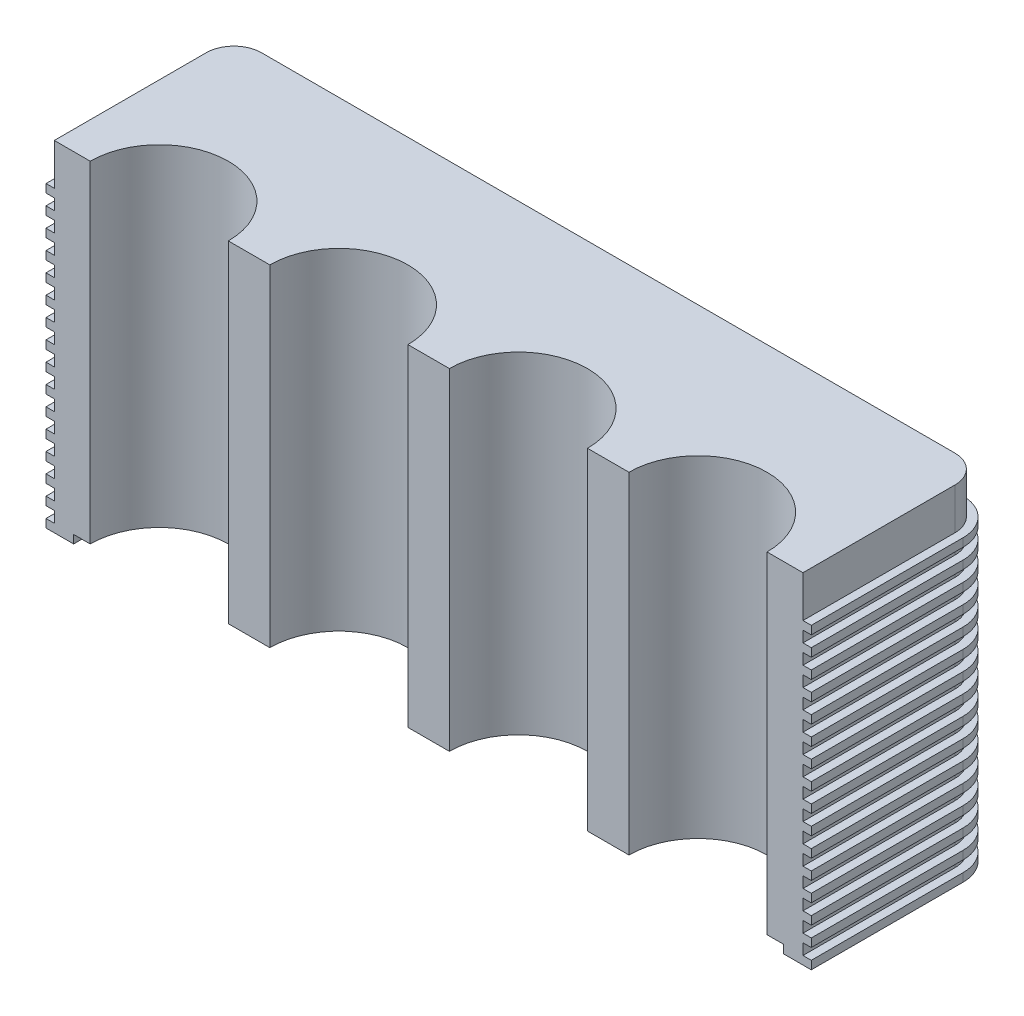
from build123d import *

# Parameters (mm, degrees)
BOSS_EXTRUDE1_DEPTH = 120
EXTRUDE_THIN1_DEPTH = 3
LPATTERN2_COUNT     = 16
LPATTERN2_PITCH     = 7


with BuildPart() as part:
    # Sketch1 → Boss-Extrude1 (new body)
    with BuildSketch(Plane(origin=(0, 0, 0), x_dir=(1, 0, 0), z_dir=(0, 1, 0))):
        with BuildLine():
            Line((0, 0), (13, 0))
            ThreePointArc((13, 0), (38, 25), (63, 0))
            Line((63, 0), (78, 0))
            ThreePointArc((78, 0), (103, 25), (128, 0))
            Line((128, 0), (143, 0))
            ThreePointArc((143, 0), (168, 25), (193, 0))
            Line((193, 0), (208, 0))
            ThreePointArc((208, 0), (233, 25), (258, 0))
            Line((258, 0), (271, 0))
            Line((271, 0), (271, 55))
            ThreePointArc((271, 55), (268.071067812, 62.071067812), (261, 65))
            Line((261, 65), (10, 65))
            ThreePointArc((10, 65), (2.928932188, 62.071067812), (0, 55))
            Line((0, 55), (0, 0))
        make_face()
    extrude(amount=BOSS_EXTRUDE1_DEPTH)

    # Sketch3 → Extrude-Thin1 (add)
    with BuildSketch(Plane.XZ):
        with BuildLine():
            Line((274, 0), (274, -55))
            ThreePointArc((274, -55), (270.192388155, -64.192388155), (261, -68))
            Line((261, -68), (10, -68))
            ThreePointArc((10, -68), (0.807611845, -64.192388155), (-3, -55))
            Line((-3, -55), (-3, 0))
            Line((-3, 0), (7, 0))
            Line((7, 0), (7, -55))
            ThreePointArc((7, -55), (7.878679656, -57.121320344), (10, -58))
            Line((10, -58), (261, -58))
            ThreePointArc((261, -58), (263.121320344, -57.121320344), (264, -55))
            Line((264, -55), (264, 0))
            Line((264, 0), (274, 0))
        make_face()
    extrude_thin1 = extrude(amount=EXTRUDE_THIN1_DEPTH)

    # LPattern2: Extrude-Thin1 ×16
    with Locations(*[(0, i * LPATTERN2_PITCH, 0) for i in range(1, LPATTERN2_COUNT)]):
        add(extrude_thin1)


solid = part.part
